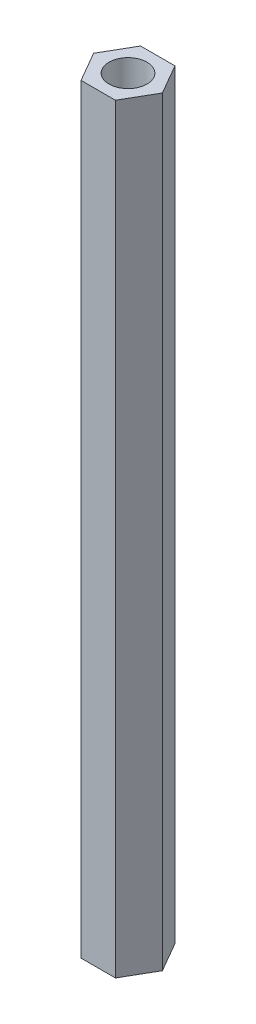
from build123d import *

# Parameters (mm, degrees)
SKETCH1_R           = 1.5
BOSS_EXTRUDE1_DEPTH = 60


with BuildPart() as part:
    # Sketch1 → Boss-Extrude1 (new body)
    with BuildSketch(Plane(origin=(0, 0, 0), x_dir=(1, 0, 0), z_dir=(0, 1, 0))):
        Polygon((2.713546265, 0), (1.356773133, 2.35), (-1.356773133, 2.35), (-2.713546265, 0), (-1.356773133, -2.35), (1.356773133, -2.35), align=None)
        with Locations(Location((0, 0, 0), (0, 0, 270))):
            Circle(SKETCH1_R, mode=Mode.SUBTRACT)
    extrude(amount=BOSS_EXTRUDE1_DEPTH)


solid = part.part
